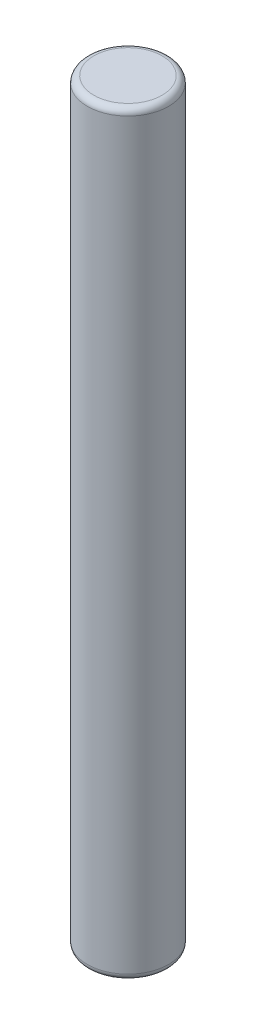
from build123d import *

# Parameters (mm, degrees)
SKETCH1_R           = 4
BOSS_EXTRUDE1_DEPTH = 74.5
FILLET1_R           = 0.635


with BuildPart() as part:
    # Sketch1 → Boss-Extrude1 (new body)
    with BuildSketch(Plane(origin=(0, 0, 0), x_dir=(1, 0, 0), z_dir=(0, 1, 0))):
        with Locations(Location((0, 0, 0), (0, 0, 270))):
            Circle(SKETCH1_R)
    extrude(amount=BOSS_EXTRUDE1_DEPTH)

    # Fillet1
    fillet1_edges = [part.edges().sort_by_distance(p)[0] for p in [
        (0, 0, -4),
        (0, 74.5, -4),
    ]]
    fillet(fillet1_edges, radius=FILLET1_R)


solid = part.part
